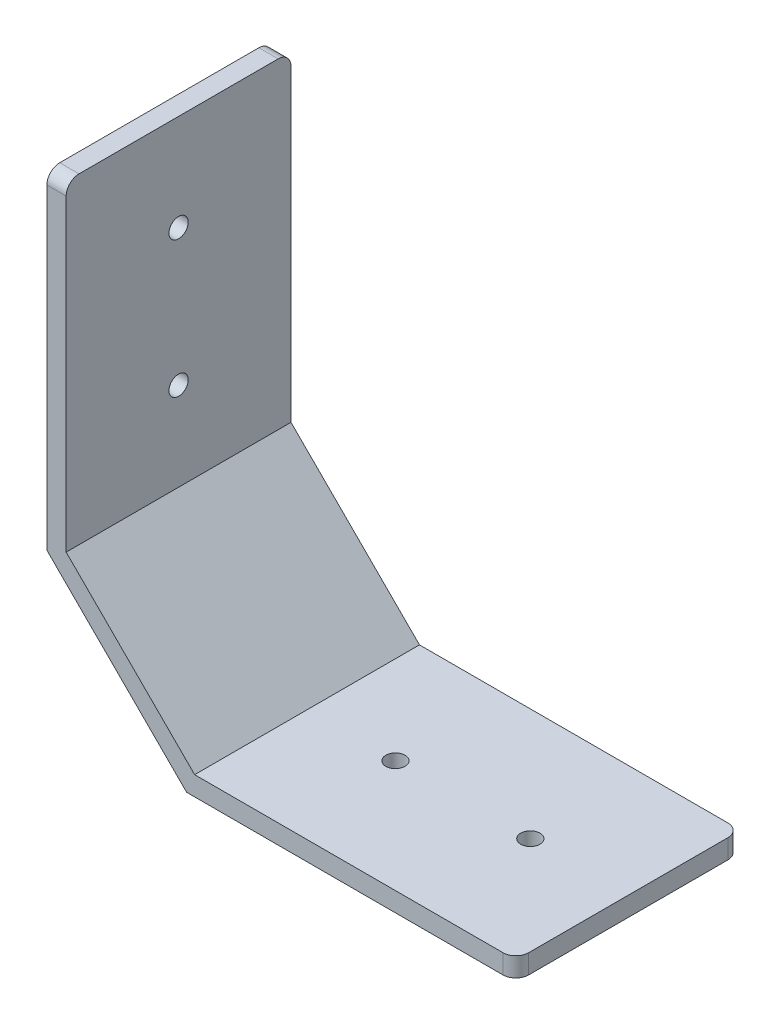
from build123d import *

# Parameters (mm, degrees)
EXTRU_MINCE1_DEPTH      = 35
CONG_3_R                = 2
CONG_4_R                = 2
CONG_5_R                = 2
CONG_6_R                = 2
ESQUISSE2_R             = 1.5
ENL_V_MAT_EXTRU_1_DEPTH = 10
ESQUISSE3_R             = 1.5
ENL_V_MAT_EXTRU_2_DEPTH = 10


with BuildPart() as part:
    # Esquisse1 → Extru.-Mince1 (new body)
    with BuildSketch(Plane.XY):
        Polygon((70, -20), (20, -20), (0, 0), (0, 50), (-3, 50), (-3, -1.242640687), (18.757359313, -23), (70, -23), align=None)
    extrude(amount=EXTRU_MINCE1_DEPTH)

    # Congé3
    cong_3_edges = [part.edges().sort_by_distance(p)[0] for p in [
        (-1.5, 50, 35),
    ]]
    fillet(cong_3_edges, radius=CONG_3_R)

    # Congé4
    cong_4_edges = [part.edges().sort_by_distance(p)[0] for p in [
        (-1.5, 50, 0),
    ]]
    fillet(cong_4_edges, radius=CONG_4_R)

    # Congé5
    cong_5_edges = [part.edges().sort_by_distance(p)[0] for p in [
        (70, -21.5, 35),
    ]]
    fillet(cong_5_edges, radius=CONG_5_R)

    # Congé6
    cong_6_edges = [part.edges().sort_by_distance(p)[0] for p in [
        (70, -21.5, 0),
    ]]
    fillet(cong_6_edges, radius=CONG_6_R)

    # Esquisse2 → Enlèv. mat.-Extru.1 (cut)
    with BuildSketch(Plane.XZ.offset(23)):
        with Locations(Location((33.757359313, 17.5, 0), (0, 0, 270))):
            Circle(ESQUISSE2_R)
        with Locations(Location((54.757359313, 17.5, 0), (0, 0, 270))):
            Circle(ESQUISSE2_R)
    extrude(amount=-ENL_V_MAT_EXTRU_1_DEPTH, mode=Mode.SUBTRACT)

    # Esquisse3 → Enlèv. mat.-Extru.2 (cut)
    with BuildSketch(Plane.ZY.offset(3)):
        with Locations((17.5, 35)):
            Circle(ESQUISSE3_R)
        with Locations((17.5, 13.757359313)):
            Circle(ESQUISSE3_R)
    extrude(amount=-ENL_V_MAT_EXTRU_2_DEPTH, mode=Mode.SUBTRACT)


solid = part.part
